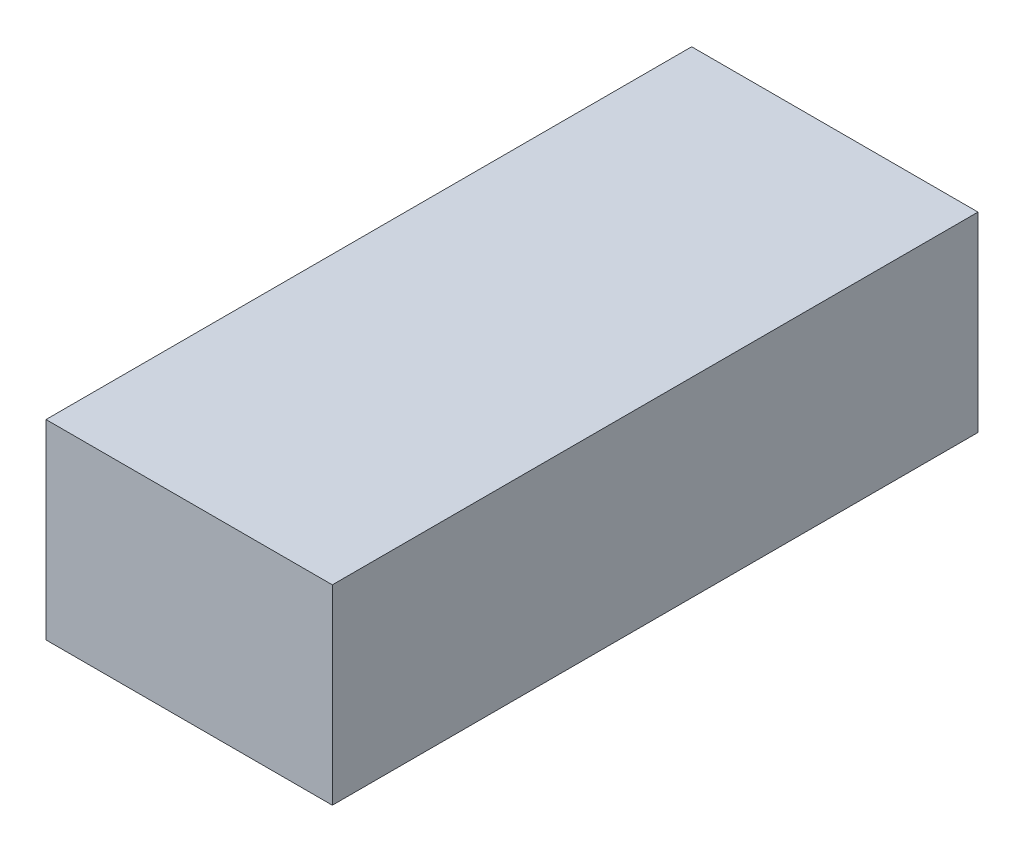
from build123d import *

# Parameters (mm, degrees)
SKETCH_1_W      = 51
SKETCH_1_H      = 115
EXTRUDE_1_DEPTH = 34


with BuildPart() as part:
    # 草图1 → 凸台-拉伸1 (new body)
    with BuildSketch(Plane(origin=(0, 0, 0), x_dir=(1, 0, 0), z_dir=(0, 1, 0))):
        with Locations((25.5, 57.5)):
            Rectangle(SKETCH_1_W, SKETCH_1_H)
    extrude(amount=EXTRUDE_1_DEPTH)


solid = part.part
